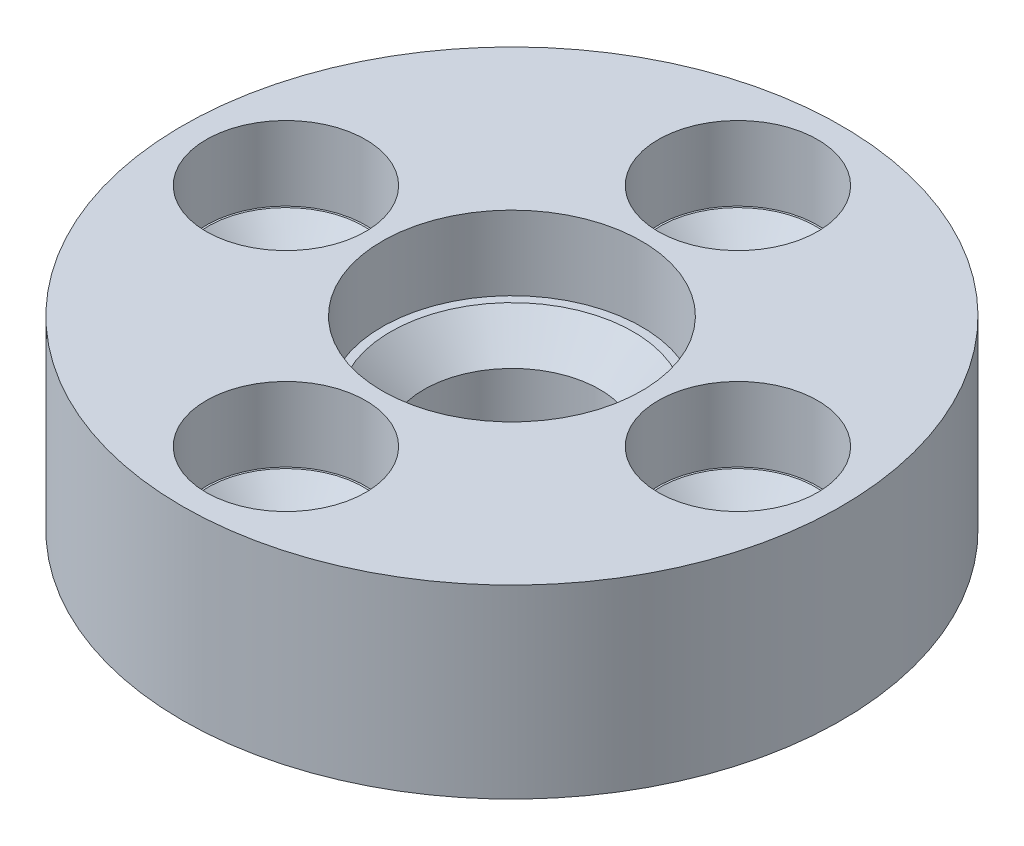
from build123d import *

# Parameters (mm, degrees)
SKETCH1_R           = 8.89
SKETCH1_R_2         = 1.2
SKETCH1_R_3         = 2.37125
BOSS_EXTRUDE1_DEPTH = 5
SKETCH2_R           = 2.15
SKETCH2_R_2         = 3.5
CUT_EXTRUDE1_DEPTH  = 2
CHAMFER1_SIZE       = 0.9


with BuildPart() as part:
    # Sketch1 → Boss-Extrude1 (new body)
    with BuildSketch(Plane(origin=(0, 0, 0), x_dir=(1, 0, 0), z_dir=(0, 1, 0))):
        Circle(SKETCH1_R)
        with Locations((0, -6.096)):
            Circle(SKETCH1_R_2, mode=Mode.SUBTRACT)
        with Locations((-6.096, 0)):
            Circle(SKETCH1_R_2, mode=Mode.SUBTRACT)
        Circle(SKETCH1_R_3, mode=Mode.SUBTRACT)
        with Locations((6.096, 0)):
            Circle(SKETCH1_R_2, mode=Mode.SUBTRACT)
        with Locations((0, 6.096)):
            Circle(SKETCH1_R_2, mode=Mode.SUBTRACT)
    extrude(amount=BOSS_EXTRUDE1_DEPTH)

    # Sketch2 → Cut-Extrude1 (cut)
    with BuildSketch(Plane(origin=(0, 5, 0), x_dir=(1, 0, 0), z_dir=(0, 1, 0))):
        with Locations((0, 6.096)):
            Circle(SKETCH2_R)
        with Locations((-6.096, 0)):
            Circle(SKETCH2_R)
        with Locations((6.096, 0)):
            Circle(SKETCH2_R)
        with Locations((0, -6.096)):
            Circle(SKETCH2_R)
        Circle(SKETCH2_R_2)
    extrude(amount=-CUT_EXTRUDE1_DEPTH, mode=Mode.SUBTRACT)

    # Chamfer1
    chamfer1_edges = [part.edges().sort_by_distance(p)[0] for p in [
        (-1.2, 3, 6.096),
        (4.896, 3, 0),
        (-2.37125, 3, 0),
        (-7.296, 3, 0),
        (-1.2, 3, -6.096),
    ]]
    chamfer(chamfer1_edges, length=CHAMFER1_SIZE)


solid = part.part
